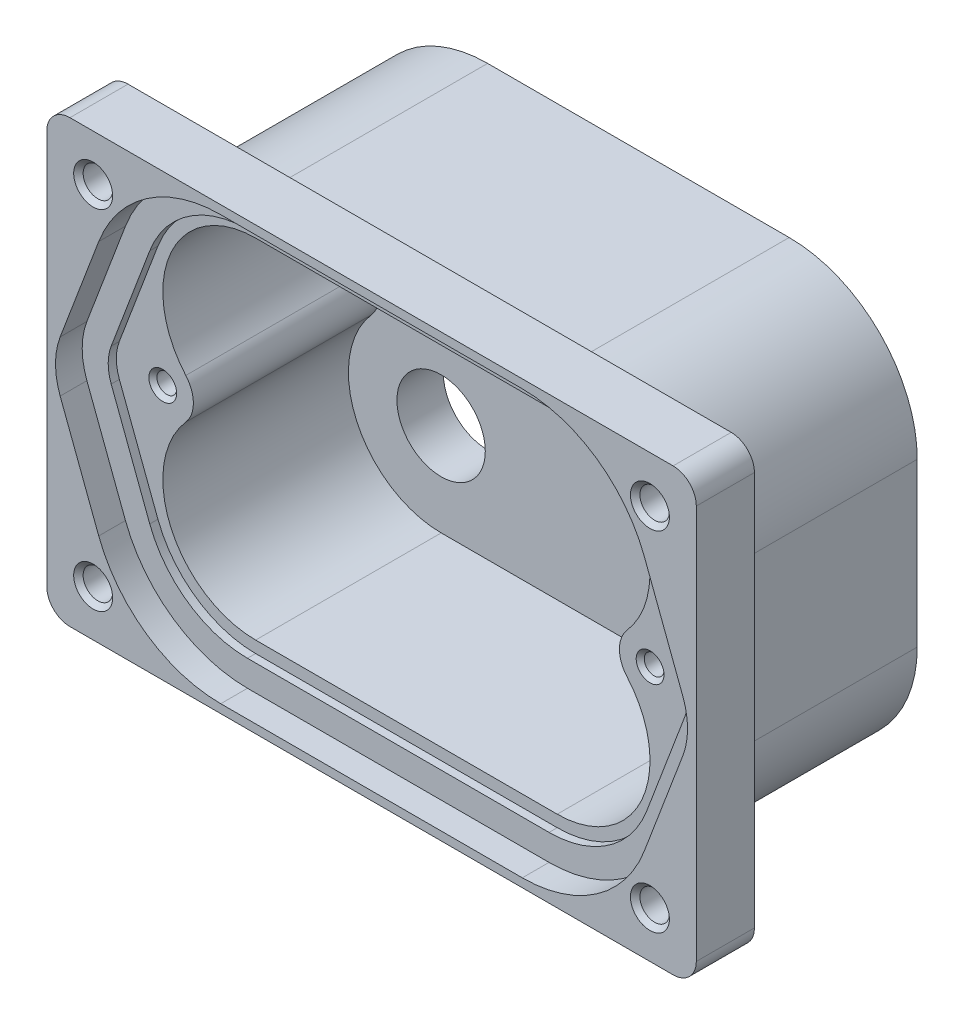
from build123d import *

# Parameters (mm, degrees)
SKETCH1_W                       = 88.9
SKETCH1_H                       = 60.325
BOSS_EXTRUDE1_DEPTH             = 36.5252
CUT_EXTRUDE1_DEPTH              = 30.1752
CUT_EXTRUDE5_DEPTH              = 4.7752
SKETCH3_R                       = 6.0452
CUT_EXTRUDE2_DEPTH              = 65.958980451
CUT_EXTRUDE3_DEPTH              = 3.6576
SKETCH8_OUTSIDE_W               = 113.594
SKETCH8_OUTSIDE_H               = 85.018
CUT_EXTRUDE4_DEPTH              = 28.575
F_10_32_TAPPED_HOLE1_AT_2_COUNT = 2
F_10_32_TAPPED_HOLE1_AT_2_PITCH = 47.6504
F_10_32_TAPPED_HOLE1_AT_3_COUNT = 2
F_10_32_TAPPED_HOLE1_AT_3_PITCH = 76.2
F_10_32_TAPPED_HOLE1_AT_4_COUNT = 2
F_10_32_TAPPED_HOLE1_AT_4_PITCH = 89.872134837
F_6_32_TAPPED_HOLE1_D           = 2.7051
F_6_32_TAPPED_HOLE1_DEPTH       = 9.398
F_6_32_TAPPED_HOLE1_CSINK_D     = 3.81
F_6_32_TAPPED_HOLE1_CSINK_ANGLE = 90
F_6_32_TAPPED_HOLE1_TIP         = 0.81269403
FILLET1_R                       = 3.175
F_8_32_TAPPED_HOLE1_AT_2_COUNT  = 2
F_8_32_TAPPED_HOLE1_AT_2_PITCH  = 9.525


with BuildPart() as part:
    # Sketch1 → Boss-Extrude1 (new body)
    with BuildSketch(Plane.XY):
        Rectangle(SKETCH1_W, SKETCH1_H)
    extrude(amount=-BOSS_EXTRUDE1_DEPTH)

    # Sketch2 → Cut-Extrude1 (cut)
    with BuildSketch(Plane.XY):
        with BuildLine():
            Line((8.699713209, 23.8252), (20.6375, 23.8252))
            ThreePointArc((20.6375, 23.8252), (32.202723567, 16.372637836), (30.194632556, 2.761515566))
            ThreePointArc((30.194632556, 2.761515566), (29.156922747, 0), (30.194632556, -2.761515566))
            ThreePointArc((30.194632556, -2.761515566), (32.202723567, -16.372637836), (20.6375, -23.8252))
            Line((20.6375, -23.8252), (8.699713209, -23.8252))
            Line((8.699713209, -23.8252), (-8.699713209, -23.8252))
            Line((-8.699713209, -23.8252), (-20.6375, -23.8252))
            ThreePointArc((-20.6375, -23.8252), (-32.202723567, -16.372637836), (-30.194632556, -2.761515566))
            ThreePointArc((-30.194632556, -2.761515566), (-29.156922747, 0), (-30.194632556, 2.761515566))
            ThreePointArc((-30.194632556, 2.761515566), (-32.202723567, 16.372637836), (-20.6375, 23.8252))
            Line((-20.6375, 23.8252), (-8.699713209, 23.8252))
            Line((-8.699713209, 23.8252), (8.699713209, 23.8252))
        make_face()
    extrude(amount=-CUT_EXTRUDE1_DEPTH, mode=Mode.SUBTRACT)

    # Sketch9 → Cut-Extrude5 (cut)
    with BuildSketch(Plane.XY):
        with BuildLine():
            Line((-20.6375, -25.4254), (20.6375, -25.4254))
            ThreePointArc((20.6375, -25.4254), (28.764361073, -22.891671397), (34.011365871, -16.188344448))
            Line((34.011365871, -16.188344448), (39.288861577, -2.248287943))
            ThreePointArc((39.288861577, -2.248287943), (39.7002, 0), (39.288861577, 2.248287943))
            Line((39.288861577, 2.248287943), (34.011365871, 16.188344448))
            ThreePointArc((34.011365871, 16.188344448), (28.764361073, 22.891671397), (20.6375, 25.4254))
            Line((20.6375, 25.4254), (-20.6375, 25.4254))
            ThreePointArc((-20.6375, 25.4254), (-28.764361073, 22.891671397), (-34.011365871, 16.188344448))
            Line((-34.011365871, 16.188344448), (-39.288861577, 2.248287943))
            ThreePointArc((-39.288861577, 2.248287943), (-39.7002, 0), (-39.288861577, -2.248287943))
            Line((-39.288861577, -2.248287943), (-34.011365871, -16.188344448))
            ThreePointArc((-34.011365871, -16.188344448), (-28.764361073, -22.891671397), (-20.6375, -25.4254))
        make_face()
    extrude(amount=-CUT_EXTRUDE5_DEPTH, mode=Mode.SUBTRACT)

    # Sketch3 → Cut-Extrude2 (cut, through all)
    with BuildSketch(Plane(origin=(0, 0, -36.5252), x_dir=(-1, 0, 0), z_dir=(0, 0, -1))):
        with Locations((-20.6502, 11.1252)):
            Circle(SKETCH3_R)
        with Locations((-20.6502, -11.1252)):
            Circle(SKETCH3_R)
        with Locations((20.6502, 11.1252)):
            Circle(SKETCH3_R)
        with Locations((20.6502, -11.1252)):
            Circle(SKETCH3_R)
    extrude(amount=-CUT_EXTRUDE2_DEPTH, mode=Mode.SUBTRACT)

    # Sketch4 → Cut-Extrude3 (cut)
    with BuildSketch(Plane.XY):
        with BuildLine():
            Line((20.6375, 28.9814), (-20.6375, 28.9814))
            ThreePointArc((-20.6375, 28.9814), (-30.78525015, 25.817614551), (-37.337016354, 17.447385697))
            Line((-37.337016354, 17.447385697), (-42.61451206, 3.507329192))
            ThreePointArc((-42.61451206, 3.507329192), (-43.2562, 0), (-42.61451206, -3.507329192))
            Line((-42.61451206, -3.507329192), (-37.337016354, -17.447385697))
            ThreePointArc((-37.337016354, -17.447385697), (-30.78525015, -25.817614551), (-20.6375, -28.9814))
            Line((-20.6375, -28.9814), (20.6375, -28.9814))
            ThreePointArc((20.6375, -28.9814), (30.78525015, -25.817614551), (37.337016354, -17.447385697))
            Line((37.337016354, -17.447385697), (42.61451206, -3.507329192))
            ThreePointArc((42.61451206, -3.507329192), (43.2562, 0), (42.61451206, 3.507329192))
            Line((42.61451206, 3.507329192), (37.337016354, 17.447385697))
            ThreePointArc((37.337016354, 17.447385697), (30.78525015, 25.817614551), (20.6375, 28.9814))
        make_face()
    extrude(amount=-CUT_EXTRUDE3_DEPTH, mode=Mode.SUBTRACT)

    # Sketch8 outside → Cut-Extrude4 (cut)
    with BuildSketch(Plane(origin=(0, 0, -36.5252), x_dir=(-1, 0, 0), z_dir=(0, 0, -1))):
        Rectangle(SKETCH8_OUTSIDE_W, SKETCH8_OUTSIDE_H)
        with BuildLine():
            Line((20.6375, -28.6512), (-20.6375, -28.6512))
            ThreePointArc((-20.6375, -28.6512), (-33.030253447, -23.517953447), (-38.1635, -11.1252))
            Line((-38.1635, -11.1252), (-38.1635, 11.1252))
            ThreePointArc((-38.1635, 11.1252), (-33.030253447, 23.517953447), (-20.6375, 28.6512))
            Line((-20.6375, 28.6512), (20.6375, 28.6512))
            ThreePointArc((20.6375, 28.6512), (33.030253447, 23.517953447), (38.1635, 11.1252))
            Line((38.1635, 11.1252), (38.1635, -11.1252))
            ThreePointArc((38.1635, -11.1252), (33.030253447, -23.517953447), (20.6375, -28.6512))
        make_face(mode=Mode.SUBTRACT)
    extrude(amount=-CUT_EXTRUDE4_DEPTH, mode=Mode.SUBTRACT)

    # Sketch6 → #10-32 Tapped Hole1 (revolve, cut)
    with BuildSketch(Plane(origin=(38.1, 23.8252, 0), x_dir=(0, -1, 0), z_dir=(1, 0, 0))):
        Polygon((0, 0), (0, 7.9502), (2.667, 7.9502), (2.0193, 7.3025), (2.0193, 0.6477), (2.667, 0), align=None)
    f_10_32_tapped_hole1 = revolve(axis=Axis((38.1, 23.8252, 6.35), (0, 0, -1)), mode=Mode.SUBTRACT)

    # #10-32 Tapped Hole1 at 2: #10-32 Tapped Hole1 ×2
    with Locations(*[(0, -i * F_10_32_TAPPED_HOLE1_AT_2_PITCH, 0) for i in range(1, F_10_32_TAPPED_HOLE1_AT_2_COUNT)]):
        add(f_10_32_tapped_hole1, mode=Mode.SUBTRACT)

    # #10-32 Tapped Hole1 at 3: #10-32 Tapped Hole1 ×2
    with Locations(*[(-i * F_10_32_TAPPED_HOLE1_AT_3_PITCH, 0, 0) for i in range(1, F_10_32_TAPPED_HOLE1_AT_3_COUNT)]):
        add(f_10_32_tapped_hole1, mode=Mode.SUBTRACT)

    # #10-32 Tapped Hole1 at 4: #10-32 Tapped Hole1 ×2
    with Locations(*[Vector(-0.8478712577397053, -0.5302021598398957, 0) * (i * F_10_32_TAPPED_HOLE1_AT_4_PITCH) for i in range(1, F_10_32_TAPPED_HOLE1_AT_4_COUNT)]):
        add(f_10_32_tapped_hole1, mode=Mode.SUBTRACT)

    # #6-32 Tapped Hole1
    with Locations(Plane.XY.offset(-4.7752)):
        with Locations((33.3502, 0), (-33.3502, 0)):
            CounterSinkHole(F_6_32_TAPPED_HOLE1_D / 2, F_6_32_TAPPED_HOLE1_CSINK_D / 2, depth=F_6_32_TAPPED_HOLE1_DEPTH, counter_sink_angle=F_6_32_TAPPED_HOLE1_CSINK_ANGLE)
            with Locations((0, 0, -(F_6_32_TAPPED_HOLE1_DEPTH + F_6_32_TAPPED_HOLE1_TIP / 2))):  # 118° drill point
                Cone(0, F_6_32_TAPPED_HOLE1_D / 2, F_6_32_TAPPED_HOLE1_TIP, mode=Mode.SUBTRACT)

    # Fillet1
    fillet1_edges = [part.edges().sort_by_distance(p)[0] for p in [
        (-44.45, -30.1625, -3.9751),
        (44.45, -30.1625, -3.9751),
        (44.45, 30.1625, -3.9751),
        (-44.45, 30.1625, -3.9751),
    ]]
    fillet(fillet1_edges, radius=FILLET1_R)

    # Sketch14 → #8-32 Tapped Hole1 (revolve, cut)
    with BuildSketch(Plane(origin=(-6.35, 15.875, -30.1752), x_dir=(0, -1, 0), z_dir=(1, 0, 0))):
        Polygon((0, 0), (0, 6.35), (2.286, 6.35), (1.7272, 5.7912), (1.7272, 0.5588), (2.286, 0), align=None)
    f_8_32_tapped_hole1 = revolve(axis=Axis((-6.35, 15.875, -23.8252), (0, 0, -1)), mode=Mode.SUBTRACT)

    # #8-32 Tapped Hole1 at 2: #8-32 Tapped Hole1 ×2
    with Locations(*[(i * F_8_32_TAPPED_HOLE1_AT_2_PITCH, 0, 0) for i in range(1, F_8_32_TAPPED_HOLE1_AT_2_COUNT)]):
        add(f_8_32_tapped_hole1, mode=Mode.SUBTRACT)


solid = part.part
